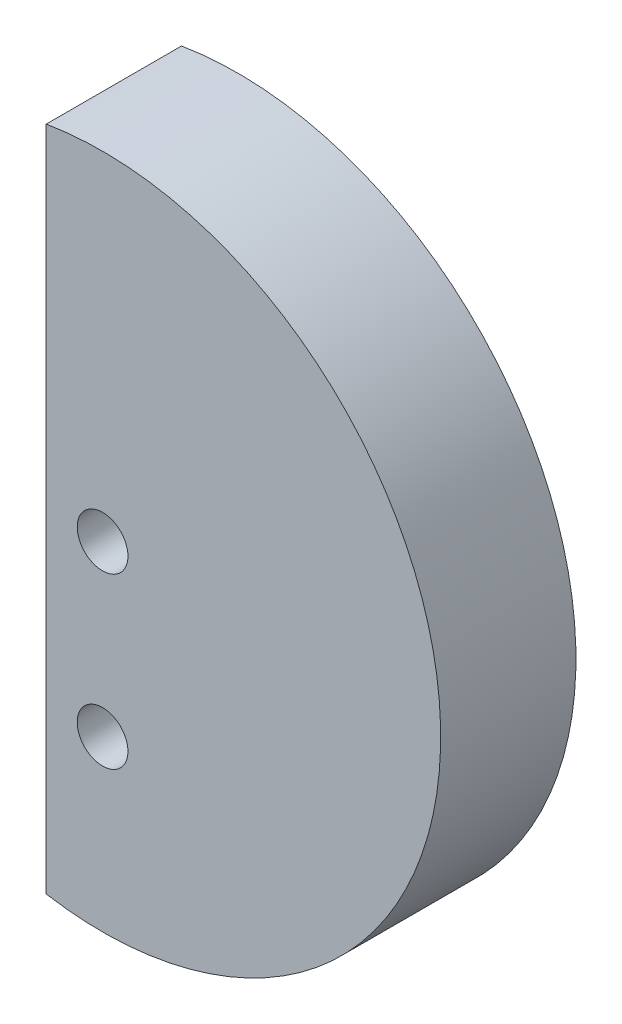
from build123d import *

# Parameters (mm, degrees)
SKETCH1_R           = 30
SKETCH1_R_2         = 2.25
BOSS_EXTRUDE1_DEPTH = 12
SKETCH2_W           = 30
SKETCH2_H           = 60
CUT_EXTRUDE1_DEPTH  = 12


with BuildPart() as part:
    # Sketch1 → Boss-Extrude1 (new body)
    with BuildSketch(Plane.XY):
        Circle(SKETCH1_R)
        Circle(SKETCH1_R_2, mode=Mode.SUBTRACT)
        with Locations((0, -15)):
            Circle(SKETCH1_R_2, mode=Mode.SUBTRACT)
    extrude(amount=BOSS_EXTRUDE1_DEPTH)

    # Sketch2 → Cut-Extrude1 (cut)
    with BuildSketch(Plane.XY.offset(12)):
        with Locations((-20, 0)):
            Rectangle(SKETCH2_W, SKETCH2_H)
    extrude(amount=-CUT_EXTRUDE1_DEPTH, mode=Mode.SUBTRACT)


solid = part.part
